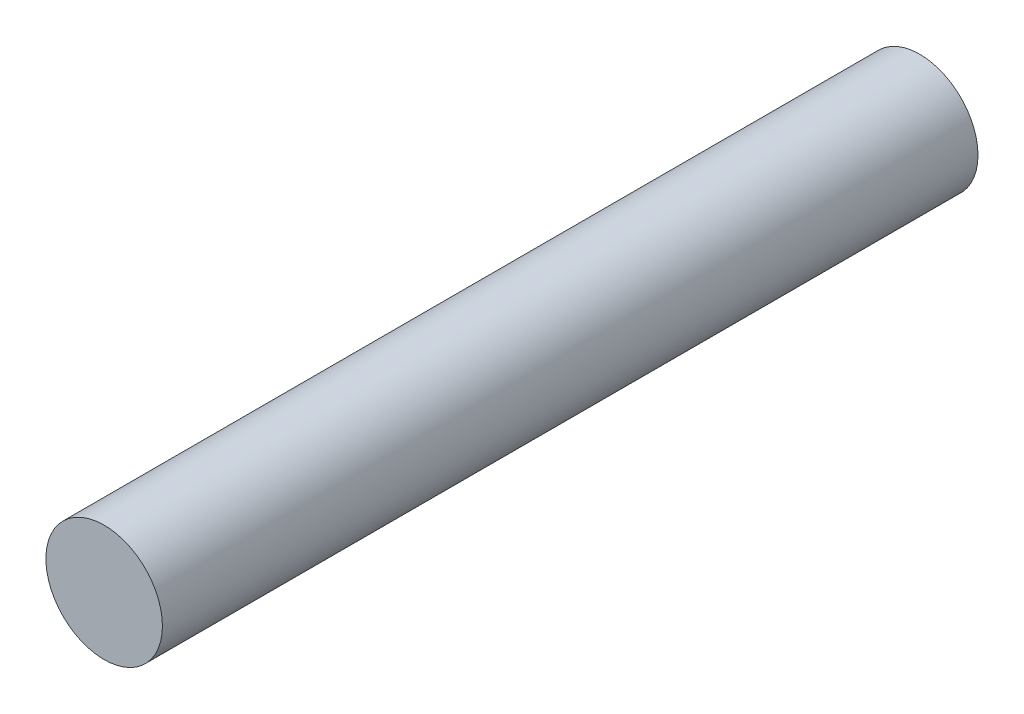
from build123d import *

# Parameters (mm, degrees)
SKETCH1_R           = 63.5
BOSS_EXTRUDE1_DEPTH = 889


with BuildPart() as part:
    # Sketch1 → Boss-Extrude1 (new body)
    with BuildSketch(Plane.XY):
        Circle(SKETCH1_R)
    extrude(amount=BOSS_EXTRUDE1_DEPTH)


solid = part.part
